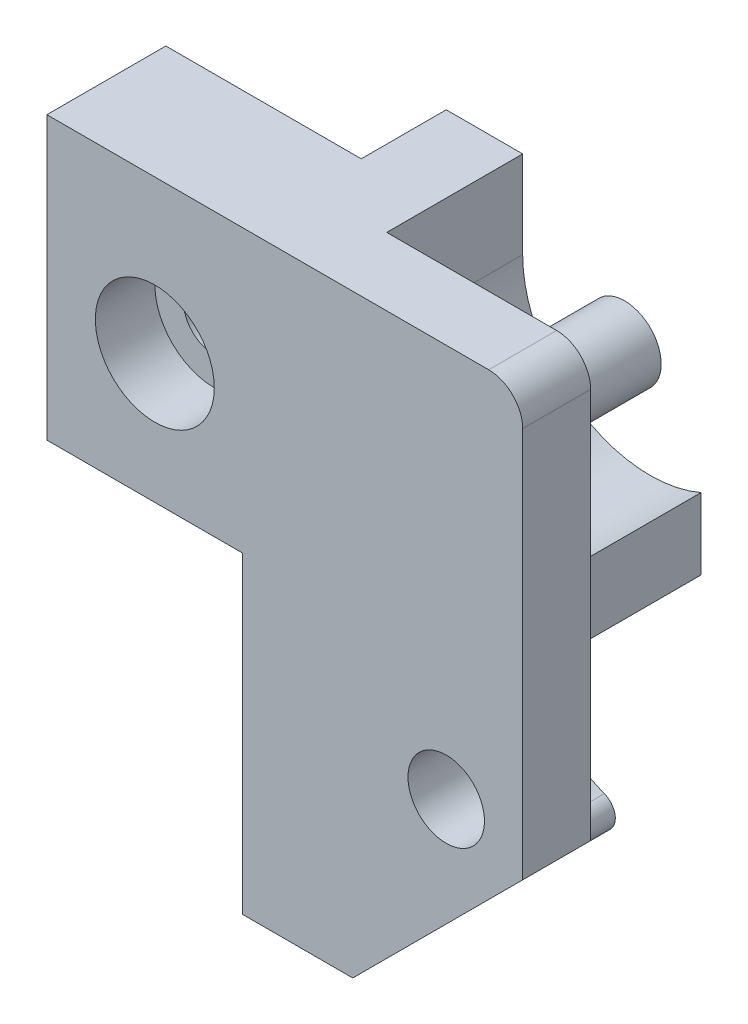
from build123d import *

# Parameters (mm, degrees)
BOSS_EXTRUDE1_DEPTH                            = 4
SKETCH2_R                                      = 2.25
CUT_EXTRUDE1_DEPTH                             = 46
SKETCH2_3_R                                    = 2.15
BOSS_EXTRUDE2_DEPTH                            = 8
BOSS_EXTRUDE4_DEPTH                            = 8
SKETCH6_W                                      = 11.5
SKETCH6_H                                      = 18.413961031
CUT_EXTRUDE2_DEPTH                             = 47.400431032
SKETCH12_W                                     = 8
SKETCH12_H                                     = 13.1
CUT_EXTRUDE3_DEPTH                             = 40.286161686
CBORE_FOR_6_SOCKET_HEAD_CAP_SCREW1_D           = 3.6576
CBORE_FOR_6_SOCKET_HEAD_CAP_SCREW1_CBORE_D     = 7
CBORE_FOR_6_SOCKET_HEAD_CAP_SCREW1_CBORE_DEPTH = 3.5052
SKETCH13_W                                     = 11.5
SKETCH13_H                                     = 16.586038969
CUT_EXTRUDE4_DEPTH                             = 5
CUT_EXTRUDE5_START                             = -1.5
SKETCH14_R                                     = 2.15
CUT_EXTRUDE5_DEPTH                             = 1.5


with BuildPart() as part:
    # Sketch1 → Boss-Extrude1 (new body)
    with BuildSketch(Plane.XY):
        with BuildLine():
            Line((18, 0), (28, 10))
            Line((28, 10), (28, 33))
            ThreePointArc((28, 33), (27.414213562, 34.414213562), (26, 35))
            Line((26, 35), (0, 35))
            Line((0, 35), (0, 0))
            Line((0, 0), (18, 0))
        make_face()
    extrude(amount=BOSS_EXTRUDE1_DEPTH)

    # Sketch2 → Cut-Extrude1 (cut, through all)
    with BuildSketch(Plane(origin=(0, 0, 0), x_dir=(-1, 0, 0), z_dir=(0, 0, -1))):
        with Locations((-23.5, 11.863961031)):
            Circle(SKETCH2_R)
    extrude(amount=-CUT_EXTRUDE1_DEPTH, mode=Mode.SUBTRACT)

    # Sketch2<3> → Boss-Extrude2 (add)
    with BuildSketch(Plane(origin=(0, 0, 0), x_dir=(-1, 0, 0), z_dir=(0, 0, -1))):
        with Locations(Location((-23.5, 29.863961031, 0), (0, 0, 180))):
            Circle(SKETCH2_3_R)
    extrude(amount=BOSS_EXTRUDE2_DEPTH)

    # Sketch2<5> → Boss-Extrude4 (add)
    with BuildSketch(Plane(origin=(0, 0, 0), x_dir=(-1, 0, 0), z_dir=(0, 0, -1))):
        with BuildLine():
            ThreePointArc((-26.5, 18.792344681), (-23.077745882, 19.402143932), (-19.745003329, 18.413961031))
            Line((-19.745003329, 18.413961031), (-15.95, 18.413961031))
            Line((-15.95, 18.413961031), (-15.95, 5.313961031))
            Line((-15.95, 5.313961031), (-19.725, 5.313961031))
            ThreePointArc((-19.725, 5.313961031), (-20.25595921, 5.035394245), (-20.807324798, 4.799782009))
            ThreePointArc((-20.807324798, 4.799782009), (-21.429052247, 4.074422526), (-21.15825613, 3.15825613))
            Line((-21.15825613, 3.15825613), (-18, 0))
            Line((-18, 0), (0, 0))
            Line((0, 0), (0, 35))
            Line((0, 35), (-16, 35))
            Line((-16, 35), (-16, 29.863961031))
            ThreePointArc((-16, 29.863961031), (-19.392080819, 23.589010832), (-26.5, 22.990097488))
            Line((-26.5, 22.990097488), (-26.5, 18.792344681))
        make_face()
    extrude(amount=BOSS_EXTRUDE4_DEPTH)

    # Sketch6 → Cut-Extrude2 (cut, through all)
    with BuildSketch(Plane(origin=(0, 0, -8), x_dir=(-1, 0, 0), z_dir=(0, 0, -1))):
        with Locations((-5.75, 9.206980515)):
            Rectangle(SKETCH6_W, SKETCH6_H)
    extrude(amount=-CUT_EXTRUDE2_DEPTH, mode=Mode.SUBTRACT)

    # Sketch12 → Cut-Extrude3 (cut, through all)
    with BuildSketch(Plane(origin=(15.95, 0, 0), x_dir=(0, 0, -1), z_dir=(1, 0, 0))):
        with Locations((4, 11.863961031)):
            Rectangle(SKETCH12_W, SKETCH12_H)
    extrude(amount=-CUT_EXTRUDE3_DEPTH, mode=Mode.SUBTRACT)

    # CBORE for #6 Socket Head Cap Screw1 (through all)
    with Locations(Plane.XY.offset(4)):
        with Locations((6.35, 26)):
            CounterBoreHole(CBORE_FOR_6_SOCKET_HEAD_CAP_SCREW1_D / 2, CBORE_FOR_6_SOCKET_HEAD_CAP_SCREW1_CBORE_D / 2, CBORE_FOR_6_SOCKET_HEAD_CAP_SCREW1_CBORE_DEPTH)

    # Sketch13 → Cut-Extrude4 (cut)
    with BuildSketch(Plane(origin=(0, 0, -8), x_dir=(-1, 0, 0), z_dir=(0, 0, -1))):
        with Locations((-5.75, 26.706980515)):
            Rectangle(SKETCH13_W, SKETCH13_H)
    extrude(amount=-CUT_EXTRUDE4_DEPTH, mode=Mode.SUBTRACT)

    # Sketch14 → Cut-Extrude5 (cut)
    with BuildSketch(Plane(origin=(0, 0, -8), x_dir=(-1, 0, 0), z_dir=(0, 0, -1)).offset(CUT_EXTRUDE5_START)):
        with Locations(Location((-23.5, 29.863961031, 0), (0, 0, 180))):
            Circle(SKETCH14_R)
    extrude(amount=CUT_EXTRUDE5_DEPTH, mode=Mode.SUBTRACT)


solid = part.part
